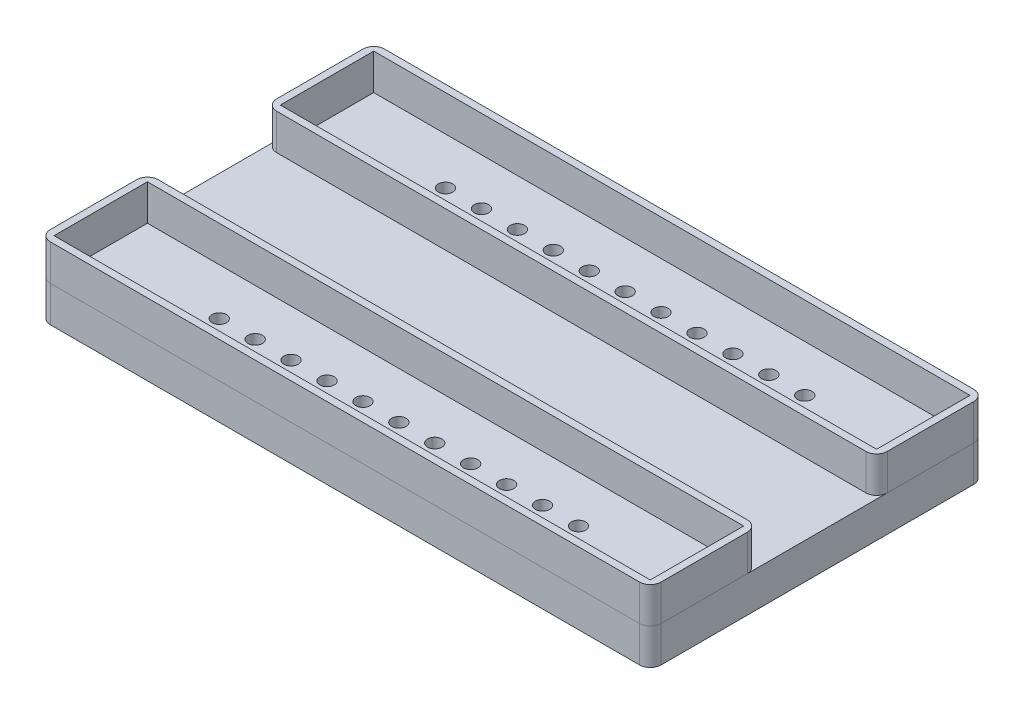
from build123d import *

# Parameters (mm, degrees)
SKETCH_1_W          = 170
SKETCH_1_H          = 93
EXTRUDE_1_DEPTH     = 10
SKETCH_2_W          = 170
SKETCH_2_H          = 30
SKETCH_2_W_2        = 166
SKETCH_2_H_2        = 26
EXTRUDE_2_DEPTH     = 10
EXTRUDE_2_2_DEPTH   = 10
SKETCH_2_4_R        = 2
CUT_EXTRUDE_2_DEPTH = 5
FILLET_2_R          = 3
FILLET_3_R          = 3
FILLET_4_R          = 3


with BuildPart() as part:
    # 草图1 → 凸台-拉伸1 (new body)
    with BuildSketch(Plane(origin=(0, 0, 0), x_dir=(1, 0, 0), z_dir=(0, 1, 0))):
        Rectangle(SKETCH_1_W, SKETCH_1_H)
    extrude(amount=EXTRUDE_1_DEPTH)

    # 草图2<4> → 切除-拉伸2 (cut)
    with BuildSketch(Plane(origin=(0, 10, 0), x_dir=(1, 0, 0), z_dir=(0, 1, 0))):
        with Locations((0, 31.5)):
            Circle(SKETCH_2_4_R)
        with Locations((10, 31.5)):
            Circle(SKETCH_2_4_R)
        with Locations((20, 31.5)):
            Circle(SKETCH_2_4_R)
        with Locations((30, 31.5)):
            Circle(SKETCH_2_4_R)
        with Locations((40, 31.5)):
            Circle(SKETCH_2_4_R)
        with Locations((50, 31.5)):
            Circle(SKETCH_2_4_R)
        with Locations((-10, 31.5)):
            Circle(SKETCH_2_4_R)
        with Locations((-20, 31.5)):
            Circle(SKETCH_2_4_R)
        with Locations((-30, 31.5)):
            Circle(SKETCH_2_4_R)
        with Locations((-40, 31.5)):
            Circle(SKETCH_2_4_R)
        with Locations((-50, 31.5)):
            Circle(SKETCH_2_4_R)
        with Locations((50, -31.5)):
            Circle(SKETCH_2_4_R)
        with Locations((40, -31.5)):
            Circle(SKETCH_2_4_R)
        with Locations((30, -31.5)):
            Circle(SKETCH_2_4_R)
        with Locations((20, -31.5)):
            Circle(SKETCH_2_4_R)
        with Locations((10, -31.5)):
            Circle(SKETCH_2_4_R)
        with Locations((0, -31.5)):
            Circle(SKETCH_2_4_R)
        with Locations((-10, -31.5)):
            Circle(SKETCH_2_4_R)
        with Locations((-20, -31.5)):
            Circle(SKETCH_2_4_R)
        with Locations((-30, -31.5)):
            Circle(SKETCH_2_4_R)
        with Locations((-40, -31.5)):
            Circle(SKETCH_2_4_R)
        with Locations((-50, -31.5)):
            Circle(SKETCH_2_4_R)
    extrude(amount=-CUT_EXTRUDE_2_DEPTH, mode=Mode.SUBTRACT)

    # 圆角4
    fillet_4_edges = [part.edges().sort_by_distance(p)[0] for p in [
        (85, 5, 46.5),
        (-85, 5, 46.5),
        (-85, 5, -46.5),
        (85, 5, -46.5),
    ]]
    fillet(fillet_4_edges, radius=FILLET_4_R)


with BuildPart() as body_2:
    # 草图2 → 凸台-拉伸2 (new body)
    with BuildSketch(Plane(origin=(0, 10, 0), x_dir=(1, 0, 0), z_dir=(0, 1, 0))):
        with Locations((0, 31.5)):
            Rectangle(SKETCH_2_W, SKETCH_2_H)
        with Locations((0, 31.5)):
            Rectangle(SKETCH_2_W_2, SKETCH_2_H_2, mode=Mode.SUBTRACT)
    extrude(amount=EXTRUDE_2_DEPTH)

    # 圆角2
    fillet_2_edges = [body_2.edges().sort_by_distance(p)[0] for p in [
        (-85, 15, -46.5),
        (85, 15, -46.5),
        (85, 15, -16.5),
        (-85, 15, -16.5),
    ]]
    fillet(fillet_2_edges, radius=FILLET_2_R)


with BuildPart() as body_3:
    # 草图2 → Extrude 2 2 (new body)
    with BuildSketch(Plane(origin=(0, 10, 0), x_dir=(1, 0, 0), z_dir=(0, 1, 0))):
        with Locations((0, -31.5)):
            Rectangle(SKETCH_2_W, SKETCH_2_H)
        with Locations((0, -31.5)):
            Rectangle(SKETCH_2_W_2, SKETCH_2_H_2, mode=Mode.SUBTRACT)
    extrude(amount=EXTRUDE_2_2_DEPTH)

    # 圆角3
    fillet_3_edges = [body_3.edges().sort_by_distance(p)[0] for p in [
        (85, 15, 46.5),
        (-85, 15, 46.5),
        (-85, 15, 16.5),
        (85, 15, 16.5),
    ]]
    fillet(fillet_3_edges, radius=FILLET_3_R)


solid = Compound([part.part, body_2.part, body_3.part])
